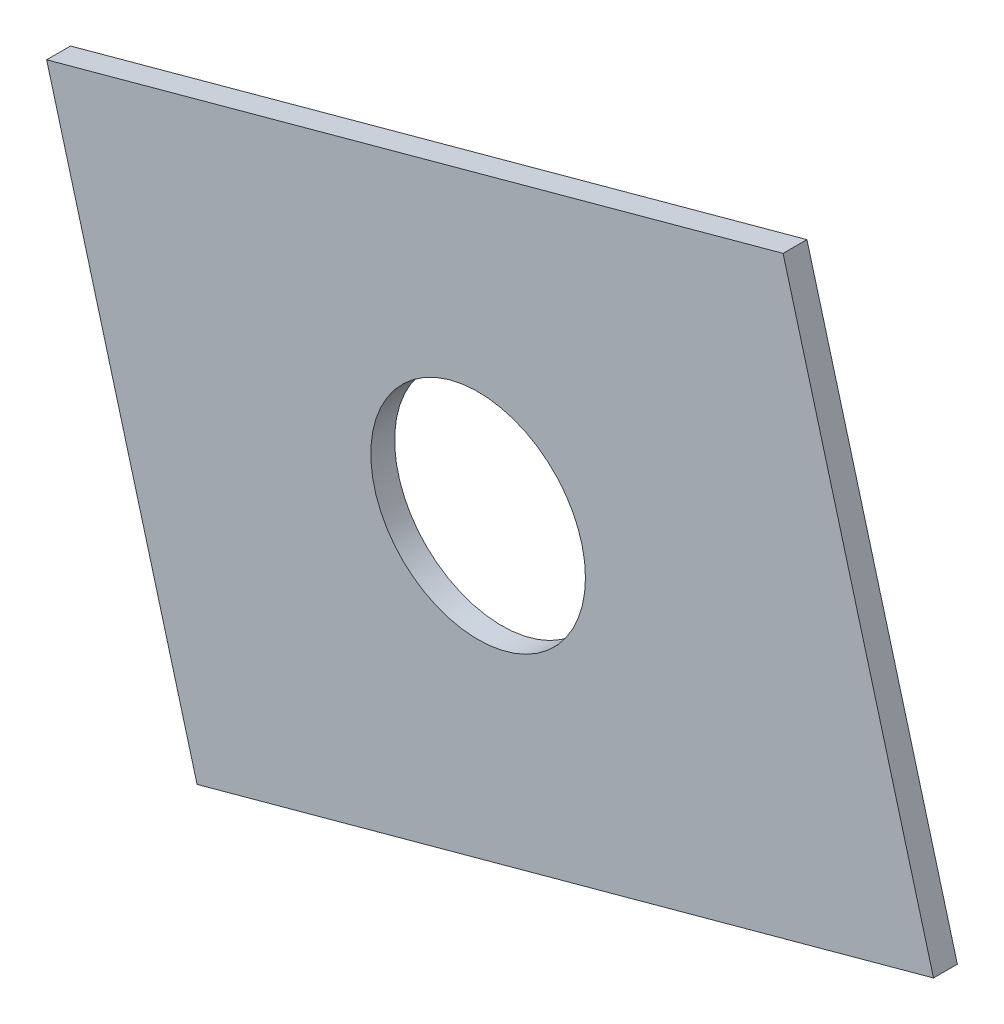
from build123d import *

# Parameters (mm, degrees)
SKETCH1_R           = 14.2875
BOSS_EXTRUDE1_DEPTH = 3.175


with BuildPart() as part:
    # Sketch1 → Boss-Extrude1 (new body)
    with BuildSketch(Plane.XY):
        Polygon((99.19567976, 12.585593729), (197.225330238, 39.28292744), (177.202329954, 112.805165298), (79.172679477, 86.107831587), align=None)
        with Locations((136.607006946, 62.261815798)):
            Circle(SKETCH1_R, mode=Mode.SUBTRACT)
    extrude(amount=BOSS_EXTRUDE1_DEPTH)


solid = part.part
